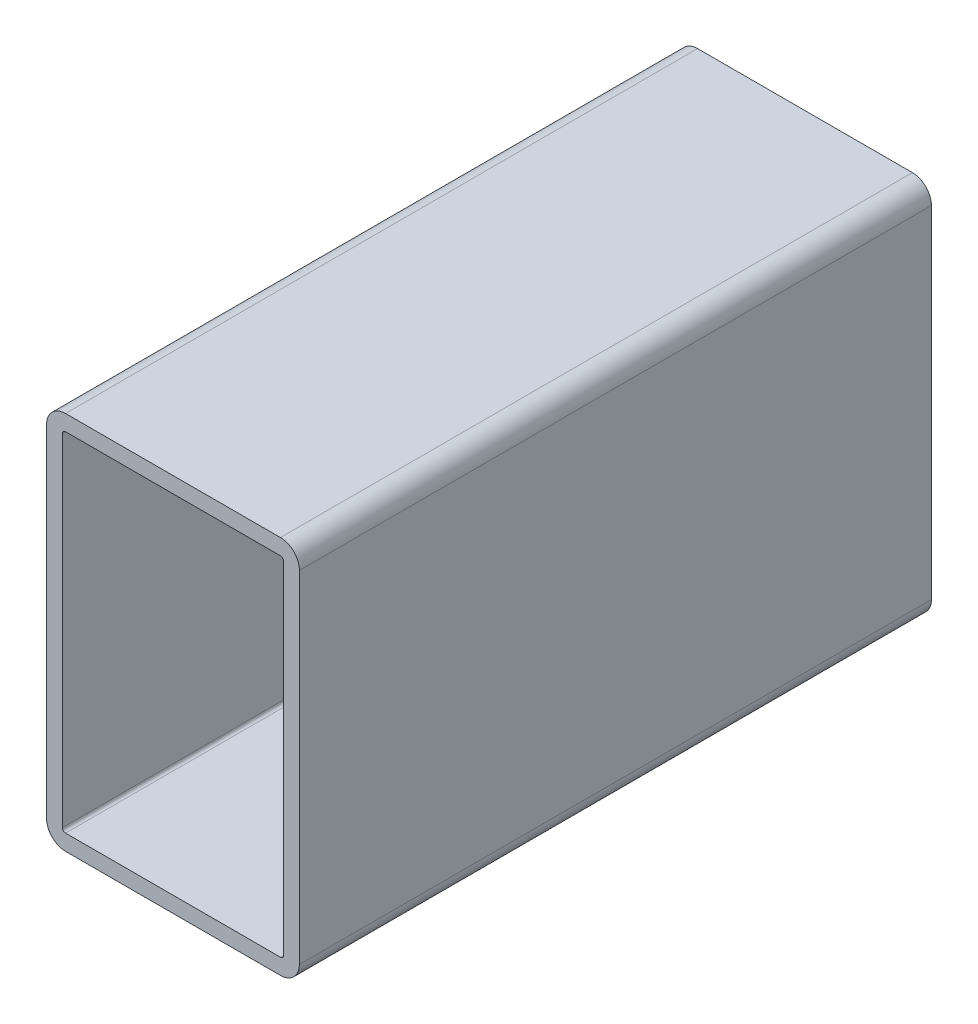
from build123d import *

# Parameters (mm, degrees)
BOSS_EXTRUDE1_DEPTH = 100


with BuildPart() as part:
    # Sketch1 → Boss-Extrude1 (new body)
    with BuildSketch(Plane.XY):
        with BuildLine():
            Line((3, 0), (37, 0))
            ThreePointArc((37, 0), (39.121320344, 0.878679656), (40, 3))
            Line((40, 3), (40, 57))
            ThreePointArc((40, 57), (39.121320344, 59.121320344), (37, 60))
            Line((37, 60), (3, 60))
            ThreePointArc((3, 60), (0.878679656, 59.121320344), (0, 57))
            Line((0, 57), (0, 3))
            ThreePointArc((0, 3), (0.878679656, 0.878679656), (3, 0))
        make_face()
        with BuildLine():
            Line((3, 2.5), (37, 2.5))
            ThreePointArc((37, 2.5), (37.353553391, 2.646446609), (37.5, 3))
            Line((37.5, 3), (37.5, 57))
            ThreePointArc((37.5, 57), (37.353553391, 57.353553391), (37, 57.5))
            Line((37, 57.5), (3, 57.5))
            ThreePointArc((3, 57.5), (2.646446609, 57.353553391), (2.5, 57))
            Line((2.5, 57), (2.5, 3))
            ThreePointArc((2.5, 3), (2.646446609, 2.646446609), (3, 2.5))
        make_face(mode=Mode.SUBTRACT)
    extrude(amount=BOSS_EXTRUDE1_DEPTH)


solid = part.part
